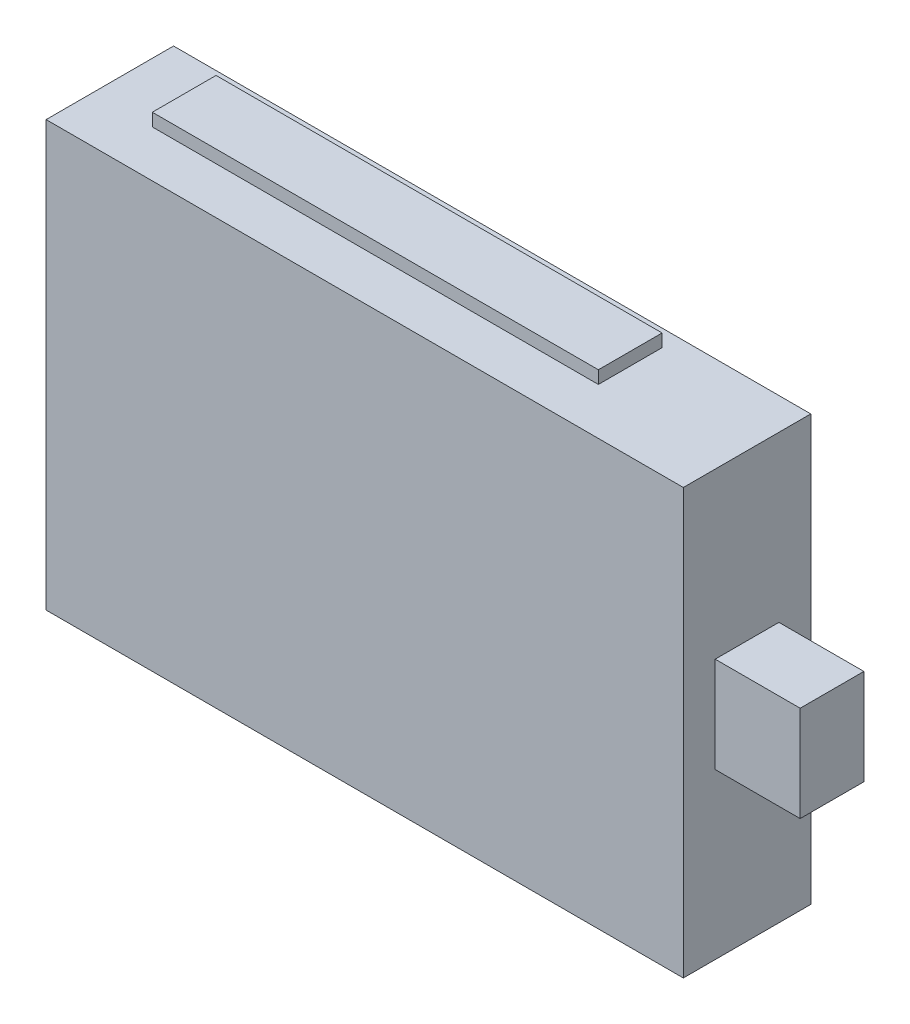
from build123d import *

# Parameters (mm, degrees)
F_5V_START                                  = -6
SKETCH_1_W                                  = 60
SKETCH_1_H                                  = 40
F_5V_BATTERY_POWER_BANK_ENVELOPE_60_X_DEPTH = 12
USB_START                                   = -3
SKETCH_2_W                                  = 8
SKETCH_2_H                                  = 9
USB_POWER_CABLE_CLEARANCE_MARKER_DEPTH      = 6
POWER_START                                 = -1
SKETCH_3_W                                  = 42
SKETCH_3_H                                  = 1.2
POWER_LABEL_PLATE_5V_POWER_DEPTH            = 6


with BuildPart() as part:
    # 草图1 → 5V battery / power bank envelope - 60 x 40 x 12 mm (new body)
    with BuildSketch(Plane.XY.offset(F_5V_START)):
        Rectangle(SKETCH_1_W, SKETCH_1_H)
    extrude(amount=F_5V_BATTERY_POWER_BANK_ENVELOPE_60_X_DEPTH)


with BuildPart() as body_2:
    # 草图2 → USB power cable clearance marker (new body)
    with BuildSketch(Plane.XY.offset(USB_START)):
        with Locations((34, 0)):
            Rectangle(SKETCH_2_W, SKETCH_2_H)
    extrude(amount=USB_POWER_CABLE_CLEARANCE_MARKER_DEPTH)


with BuildPart() as body_3:
    # 草图3 → power label plate - 5V POWER (new body)
    with BuildSketch(Plane.XY.offset(POWER_START)):
        with Locations((0, 24)):
            Rectangle(SKETCH_3_W, SKETCH_3_H)
    extrude(amount=POWER_LABEL_PLATE_5V_POWER_DEPTH)


solid = Compound([part.part, body_2.part, body_3.part])
